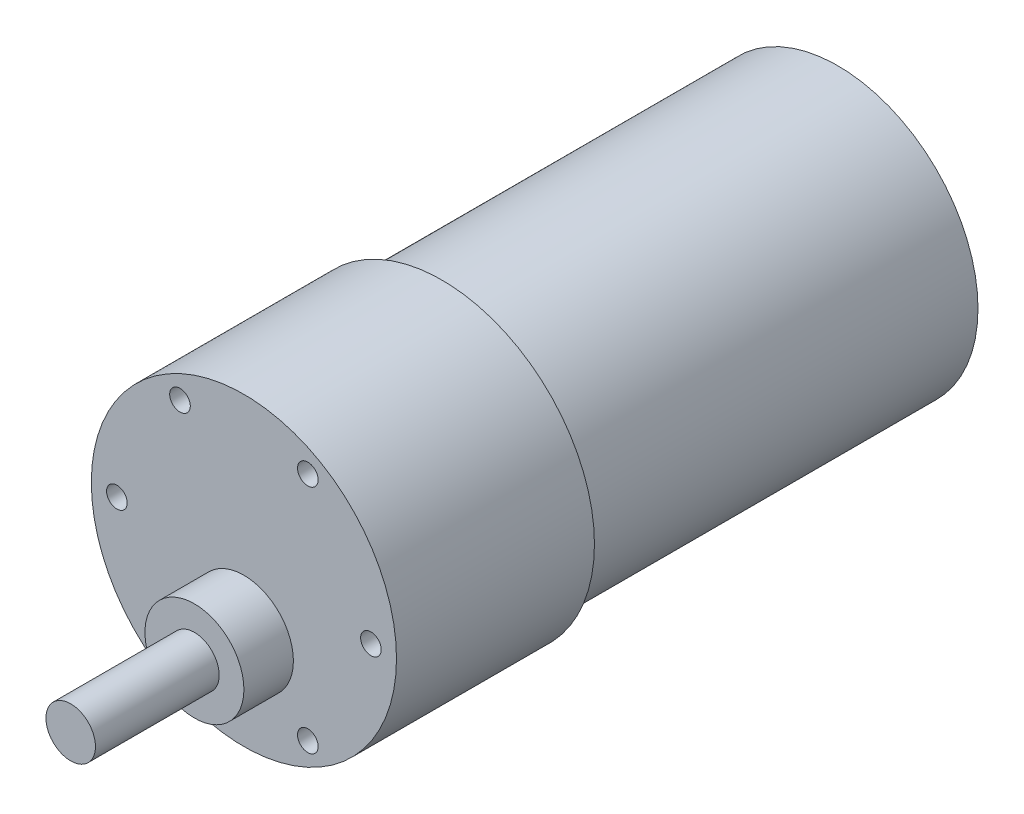
from build123d import *

# Parameters (mm, degrees)
CROQUIS1_R              = 17
SALIENTE_EXTRUIR1_DEPTH = 48
CROQUIS2_R              = 18.5
SALIENTE_EXTRUIR2_DEPTH = 24
CROQUIS3_R              = 6
SALIENTE_EXTRUIR3_DEPTH = 6
CROQUIS4_R              = 3
SALIENTE_EXTRUIR4_DEPTH = 15
CROQUIS5_R              = 1.25
CORTAR_EXTRUIR3_DEPTH   = 14


with BuildPart() as part:
    # Croquis1 → Saliente-Extruir1 (new body)
    with BuildSketch(Plane.XY):
        Circle(CROQUIS1_R)
    extrude(amount=SALIENTE_EXTRUIR1_DEPTH)

    # Croquis2 → Saliente-Extruir2 (add)
    with BuildSketch(Plane.XY.offset(48)):
        Circle(CROQUIS2_R)
    extrude(amount=SALIENTE_EXTRUIR2_DEPTH)

    # Croquis3 → Saliente-Extruir3 (add)
    with BuildSketch(Plane.XY.offset(72)):
        with Locations((0, -6.5)):
            Circle(CROQUIS3_R)
    extrude(amount=SALIENTE_EXTRUIR3_DEPTH)

    # Croquis4 → Saliente-Extruir4 (add)
    with BuildSketch(Plane.XY.offset(78)):
        with Locations((0, -6.5)):
            Circle(CROQUIS4_R)
    extrude(amount=SALIENTE_EXTRUIR4_DEPTH)

    # Croquis5 → Cortar-Extruir3 (cut)
    with BuildSketch(Plane.XY.offset(72)):
        with Locations((-7.75, -14)):
            Circle(CROQUIS5_R)
        with Locations((7.75, -14)):
            Circle(CROQUIS5_R)
        with Locations((-15.4, 0)):
            Circle(CROQUIS5_R)
        with Locations((15.4, 0)):
            Circle(CROQUIS5_R)
        with Locations((-7.75, 14)):
            Circle(CROQUIS5_R)
        with Locations((7.75, 14)):
            Circle(CROQUIS5_R)
    extrude(amount=-CORTAR_EXTRUIR3_DEPTH, mode=Mode.SUBTRACT)


solid = part.part
